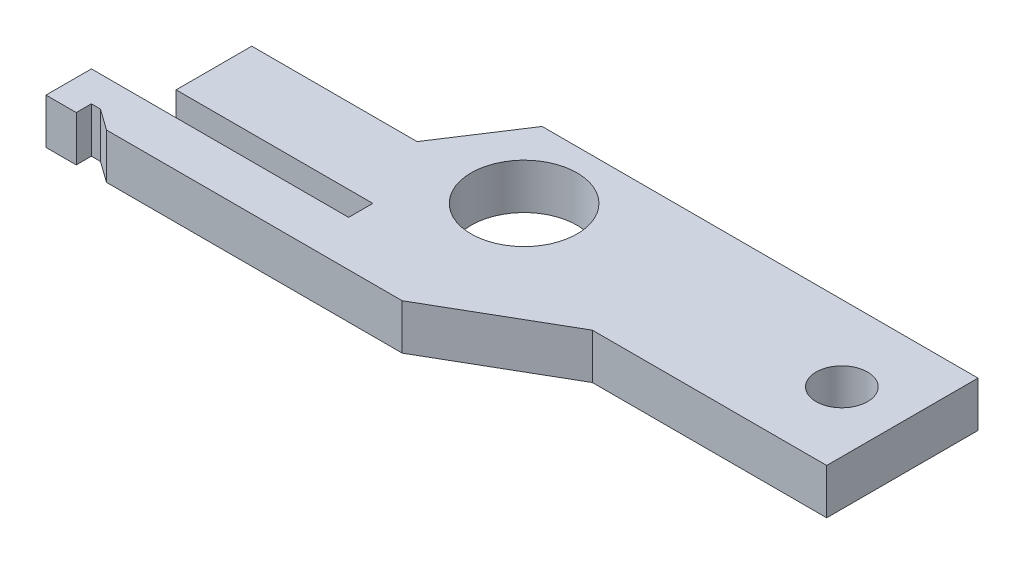
from build123d import *

# Parameters (mm, degrees)
SKETCH_2_R      = 0.85
SKETCH_2_R_2    = 1.75
EXTRUDE_1_DEPTH = 1.5


with BuildPart() as part:
    # 草图2 → 凸台-拉伸1 (new body)
    with BuildSketch(Plane(origin=(0, 7.096792112, 0), x_dir=(1, 0, 0), z_dir=(0, 1, 0))):
        Polygon((-1.9, 0), (-10.4, 0), (-10.4, -1.5), (-9.4, -1.5), (-9.4, -1), (-9.1, -1), (-8.4, -1.5), (1.371788561, -1.5), (5.355505418, 0.8), (13.1, 0.8), (13.1, 5.8), (-1.303412873, 5.8), (-2.936751866, 3.3), (-8.4, 3.3), (-8.4, 0.8), (-1.9, 0.8), align=None)
        with Locations(Location((11.1, 3.3, 0), (0, 0, 180))):
            Circle(SKETCH_2_R, mode=Mode.SUBTRACT)
        with Locations(Location((0.6, 3.3, 0), (0, 0, 180))):
            Circle(SKETCH_2_R_2, mode=Mode.SUBTRACT)
    extrude(amount=-EXTRUDE_1_DEPTH)


solid = part.part
